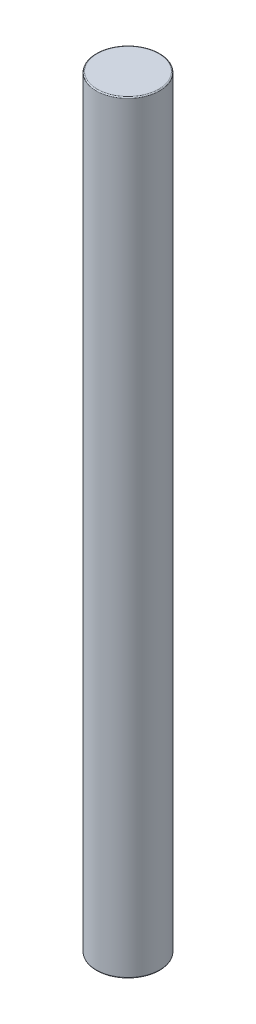
from build123d import *

# Parameters (mm, degrees)
SKETCH1_R           = 76.2
BOSS_EXTRUDE1_DEPTH = 1828.8
FILLET1_R           = 2.54


with BuildPart() as part:
    # Sketch1 → Boss-Extrude1 (new body)
    with BuildSketch(Plane(origin=(0, 0, 0), x_dir=(1, 0, 0), z_dir=(0, 1, 0))):
        with Locations(Location((0, 0, 0), (0, 0, 270))):
            Circle(SKETCH1_R)
    extrude(amount=BOSS_EXTRUDE1_DEPTH)

    # Fillet1
    fillet1_edges = [part.edges().sort_by_distance(p)[0] for p in [
        (0, 0, -76.2),
        (0, 1828.8, -76.2),
    ]]
    fillet(fillet1_edges, radius=FILLET1_R)


solid = part.part
